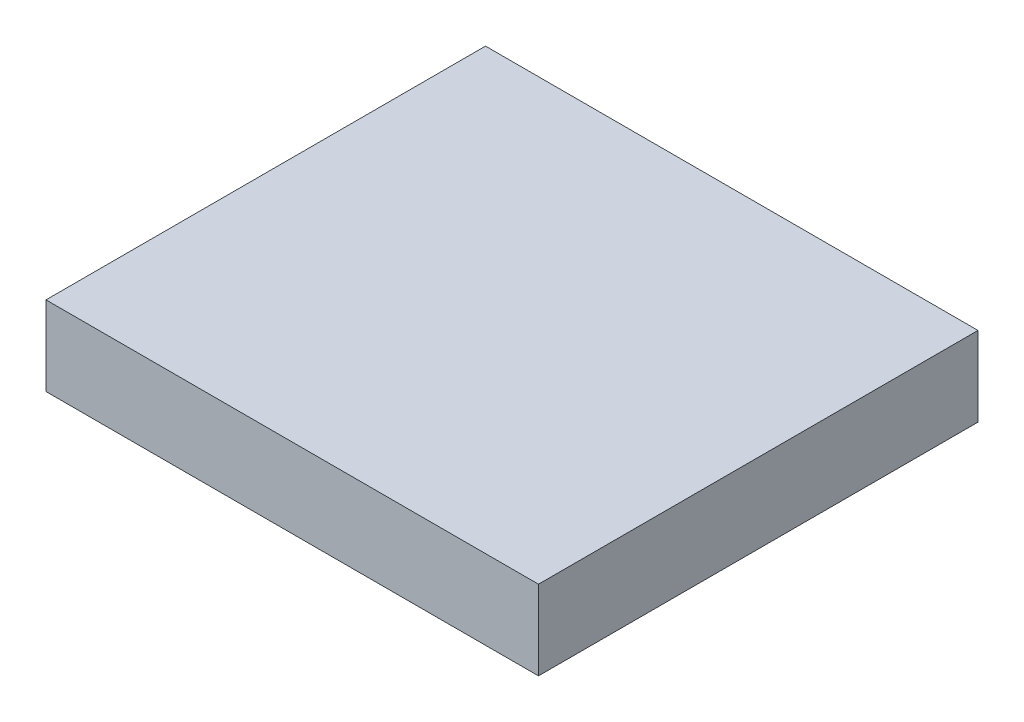
from build123d import *

# Parameters (mm, degrees)
SKETCH2_W           = 93
SKETCH2_H           = 83
BOSS_EXTRUDE1_DEPTH = 15


with BuildPart() as part:
    # Sketch2 → Boss-Extrude1 (new body)
    with BuildSketch(Plane(origin=(0, 0, 0), x_dir=(1, 0, 0), z_dir=(0, 1, 0))):
        Rectangle(SKETCH2_W, SKETCH2_H)
    extrude(amount=BOSS_EXTRUDE1_DEPTH)


solid = part.part
